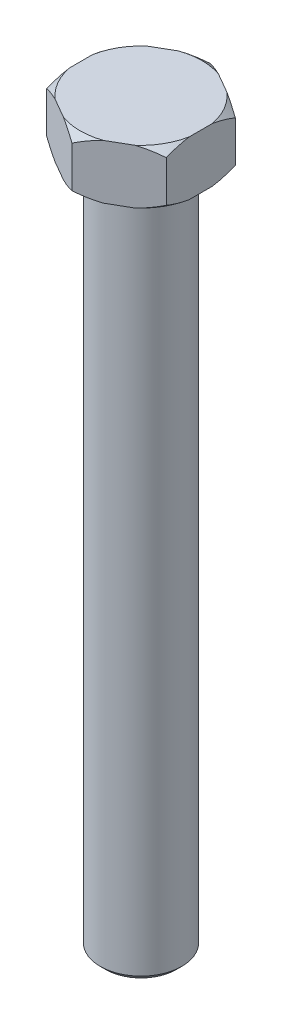
from build123d import *

# Parameters (mm, degrees)
BOSS_EXTRUDE1_DEPTH = 10
SKETCH2_R           = 7.5
BOSS_EXTRUDE2_DEPTH = 126
CHAMFER1_SIZE       = 1
SCALE1_SCALE        = 0.25


with BuildPart() as part:
    # Sketch1 → Boss-Extrude1 (new body)
    with BuildSketch(Plane(origin=(0, 0, 0), x_dir=(1, 0, 0), z_dir=(0, 1, 0))):
        Polygon((11, -6.350852961), (11, 6.350852961), (0, 12.701705922), (-11, 6.350852961), (-11, -6.350852961), (0, -12.701705922), align=None)
    extrude(amount=-BOSS_EXTRUDE1_DEPTH)

    # Sketch2 → Boss-Extrude2 (add)
    with BuildSketch(Plane.XZ.offset(10)):
        with Locations(Location((0, 0, 0), (0, 0, 90))):
            Circle(SKETCH2_R)
    extrude(amount=BOSS_EXTRUDE2_DEPTH)

    # Sketch3 → Cut-Revolve1 (revolve, cut)
    with BuildSketch(Plane(origin=(0, 0, 0), x_dir=(0, 0, -1), z_dir=(1, 0, 0))):
        Polygon((-12.701705922, -1.2), (-11.201705922, 0), (-12.701705922, 0), align=None)
        Polygon((-12.701705922, -10), (-12.701705922, -8.8), (-11.201705922, -10), align=None)
    revolve(axis=Axis((0, 3.86627359, 0), (0, -1, 0)), mode=Mode.SUBTRACT)

    # Chamfer1
    chamfer1_edges = [part.edges().sort_by_distance(p)[0] for p in [
        (0, -136, -7.5),
    ]]
    chamfer(chamfer1_edges, length=CHAMFER1_SIZE)


with BuildPart() as part_1:
    # Scale1: scaled about (0, -62.210522466, 0)
    add(part.part.scale(SCALE1_SCALE).moved(Location((0, -46.65789185, 0))))


solid = part_1.part
